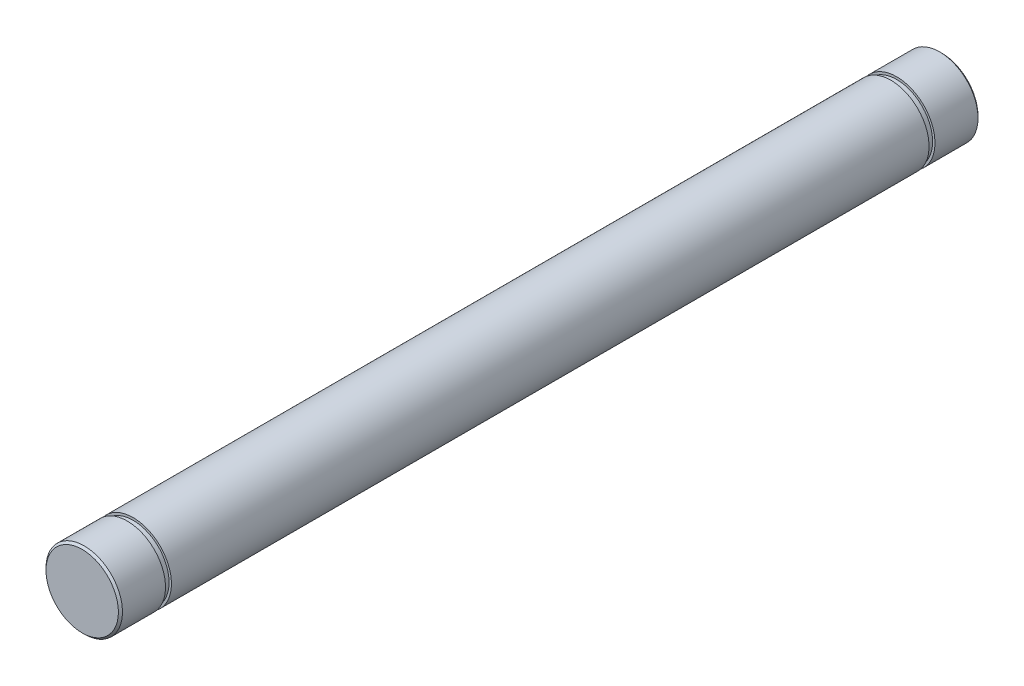
from build123d import *

# Parameters (mm, degrees)
SKETCH1_R           = 4.7625
BOSS_EXTRUDE1_DEPTH = 107.061
SKETCH2_R           = 5.514901598
SKETCH2_R_2         = 4.4704
CUT_EXTRUDE1_DEPTH  = 0.7366
CUT_EXTRUDE2_START  = 0.7366
SKETCH3_R           = 6.35
SKETCH3_R_2         = 4.4704
CUT_EXTRUDE2_DEPTH  = 0.7366
CHAMFER1_SIZE       = 0.254


with BuildPart() as part:
    # Sketch1 → Boss-Extrude1 (new body)
    with BuildSketch(Plane.XY):
        with Locations(Location((0, 0, 0), (0, 0, 180))):
            Circle(SKETCH1_R)
    extrude(amount=BOSS_EXTRUDE1_DEPTH)

    # Sketch2 → Cut-Extrude1 (cut)
    with BuildSketch(Plane.XY.offset(100.711)):
        Circle(SKETCH2_R)
        Circle(SKETCH2_R_2, mode=Mode.SUBTRACT)
    extrude(amount=CUT_EXTRUDE1_DEPTH, mode=Mode.SUBTRACT)

    # Sketch3 → Cut-Extrude2 (cut)
    with BuildSketch(Plane(origin=(0, 0, 6.35), x_dir=(-1, 0, 0), z_dir=(0, 0, -1)).offset(CUT_EXTRUDE2_START)):
        Circle(SKETCH3_R)
        with Locations(Location((0, 0, 0), (0, 0, 180))):
            Circle(SKETCH3_R_2, mode=Mode.SUBTRACT)
    extrude(amount=-CUT_EXTRUDE2_DEPTH, mode=Mode.SUBTRACT)

    # Chamfer1
    chamfer1_edges = [part.edges().sort_by_distance(p)[0] for p in [
        (4.7625, 0, 0),
        (4.7625, 0, 107.061),
    ]]
    chamfer(chamfer1_edges, length=CHAMFER1_SIZE)


solid = part.part
